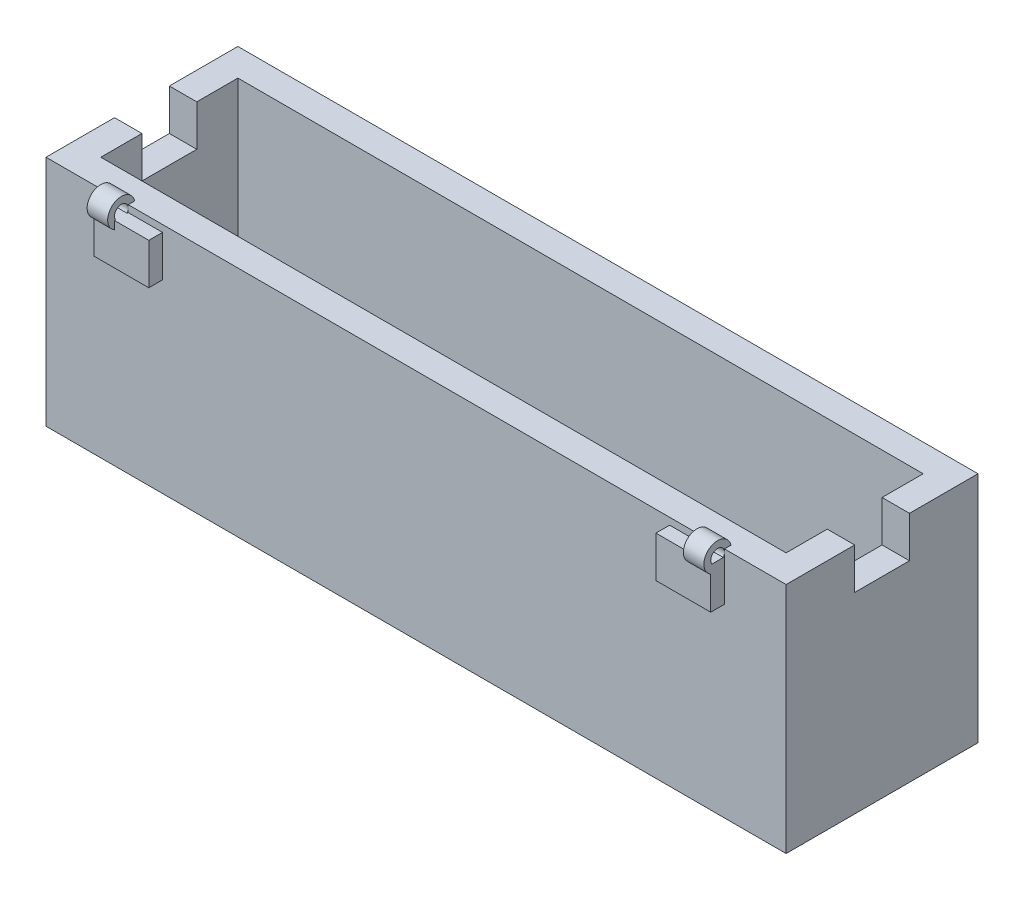
from build123d import *

# Parameters (mm, degrees)
SKETCH_1_W          = 540
SKETCH_1_H          = 140
EXTRUDE_1_DEPTH     = 140
SKETCH_2_W          = 500
SKETCH_2_H          = 100
CUT_EXTRUDE_1_DEPTH = 150
SKETCH_4_W          = 40
SKETCH_4_H          = 30
EXTRUDE_2_DEPTH     = 30
SKETCH_5_W          = 40
SKETCH_5_H          = 30
EXTRUDE_3_DEPTH     = 30
SKETCH_7_R          = 10
SKETCH_7_R_2        = 5
EXTRUDE_1_2_DEPTH   = 15
EXTRUDE_START       = -15
SKETCH_9_R          = 10
SKETCH_9_R_2        = 5
EXTRUDE_2_2_DEPTH   = 15
SKETCH_11_W         = 40
SKETCH_11_H         = 30
CUT_EXTRUDE_3_DEPTH = 567.267937246
SKETCH_13_W         = 540
SKETCH_13_H         = 140
EXTRUDE_6_DEPTH     = 30


with BuildPart() as part:
    # 草圖1 → Extrude 1 (new body)
    with BuildSketch(Plane(origin=(0, 0, 0), x_dir=(1, 0, 0), z_dir=(0, 1, 0))):
        Rectangle(SKETCH_1_W, SKETCH_1_H)
    extrude(amount=EXTRUDE_1_DEPTH)

    # 草圖2 → 除料-伸長1 (cut)
    with BuildSketch(Plane(origin=(0, 140, 0), x_dir=(1, 0, 0), z_dir=(0, 1, 0))):
        Rectangle(SKETCH_2_W, SKETCH_2_H)
    extrude(amount=-CUT_EXTRUDE_1_DEPTH, mode=Mode.SUBTRACT)

    # 草圖4 → Extrude 2 (add)
    with BuildSketch(Plane.XY.offset(80)):
        with Locations((-205, 120)):
            Rectangle(SKETCH_4_W, SKETCH_4_H)
    extrude(amount=-EXTRUDE_2_DEPTH)

    # 草圖5 → 填料-伸長3 (add)
    with BuildSketch(Plane.XY.offset(80)):
        with Locations((205, 120)):
            Rectangle(SKETCH_5_W, SKETCH_5_H)
    extrude(amount=-EXTRUDE_3_DEPTH)

    # 草圖7 → Extrude 1 2 (add)
    with BuildSketch(Plane(origin=(225, 0, 0), x_dir=(0, 0, -1), z_dir=(1, 0, 0))):
        with Locations((-75, 137.764599119)):
            Circle(SKETCH_7_R)
        with Locations((-75, 137.764599119)):
            Circle(SKETCH_7_R_2, mode=Mode.SUBTRACT)
    extrude(amount=-EXTRUDE_1_2_DEPTH)

    # 草圖9 → Extrude 2 2 (add)
    with BuildSketch(Plane.ZY.offset(225).offset(EXTRUDE_START)):
        with Locations((75, 137.764599119)):
            Circle(SKETCH_9_R)
        with Locations((75, 137.764599119)):
            Circle(SKETCH_9_R_2, mode=Mode.SUBTRACT)
    extrude(amount=EXTRUDE_2_2_DEPTH)

    # 草圖11 → 除料-伸長3 (cut, through all)
    with BuildSketch(Plane.ZY.offset(270)):
        with Locations((0, 125)):
            Rectangle(SKETCH_11_W, SKETCH_11_H)
    extrude(amount=-CUT_EXTRUDE_3_DEPTH, mode=Mode.SUBTRACT)

    # 草圖13 → 填料-伸長6 (add)
    with BuildSketch(Plane.XZ):
        Rectangle(SKETCH_13_W, SKETCH_13_H)
    extrude(amount=EXTRUDE_6_DEPTH)


solid = part.part
